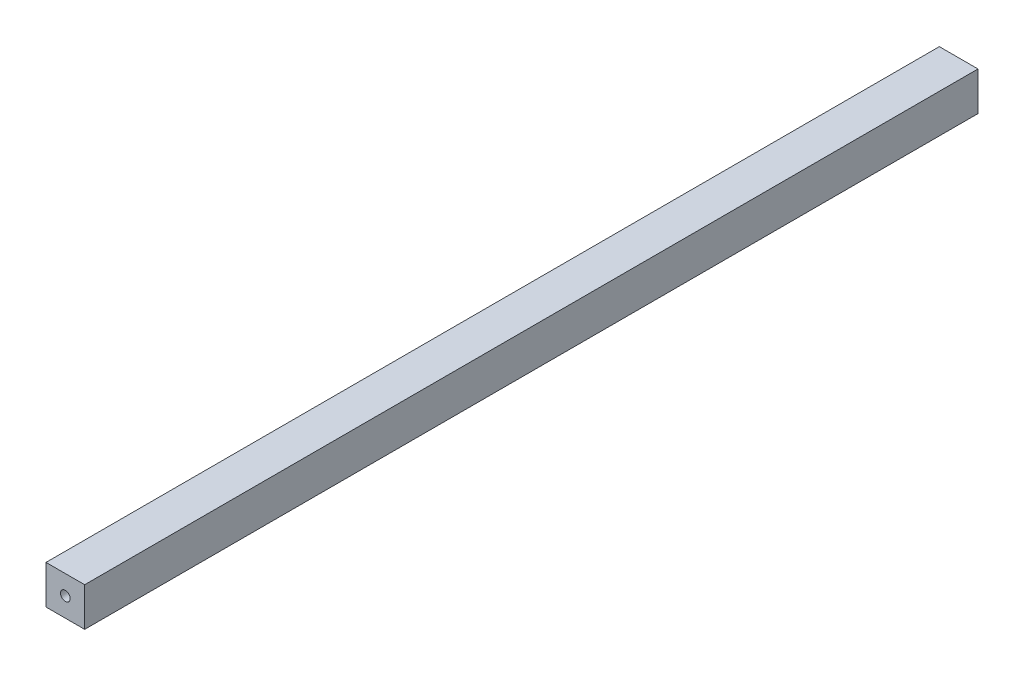
from build123d import *

# Parameters (mm, degrees)
BOSS_EXTRU_1_DEPTH        = 115.5
BOSS_EXTRU_1_DEPTH_BACK   = 115.5
ESQUISSE1_W               = 10
ESQUISSE1_H               = 10
TROU_TARAUD_M3X0_51_D     = 2.5
TROU_TARAUD_M3X0_51_DEPTH = 8.5
TROU_TARAUD_M3X0_52_D     = 2.5
TROU_TARAUD_M3X0_52_DEPTH = 8.5


with BuildPart() as part:
    # Esquisse1 → Boss.-Extru.1 (new, two sides: drawn at the far end of the back side and taken through both)
    with BuildSketch(Plane.XY.offset(-BOSS_EXTRU_1_DEPTH_BACK)):
        Rectangle(ESQUISSE1_W, ESQUISSE1_H)
    extrude(amount=BOSS_EXTRU_1_DEPTH + BOSS_EXTRU_1_DEPTH_BACK)

    # Trou taraudé M3x0.51
    with Locations(Plane.XY.offset(115.5)):
        with Locations((0, 0)):
            Hole(TROU_TARAUD_M3X0_51_D / 2, depth=TROU_TARAUD_M3X0_51_DEPTH)

    # Trou taraudé M3x0.52
    with Locations(Plane(origin=(0, 0, -115.5), x_dir=(-1, 0, 0), z_dir=(0, 0, -1))):
        with Locations((0, 0)):
            Hole(TROU_TARAUD_M3X0_52_D / 2, depth=TROU_TARAUD_M3X0_52_DEPTH)


solid = part.part
